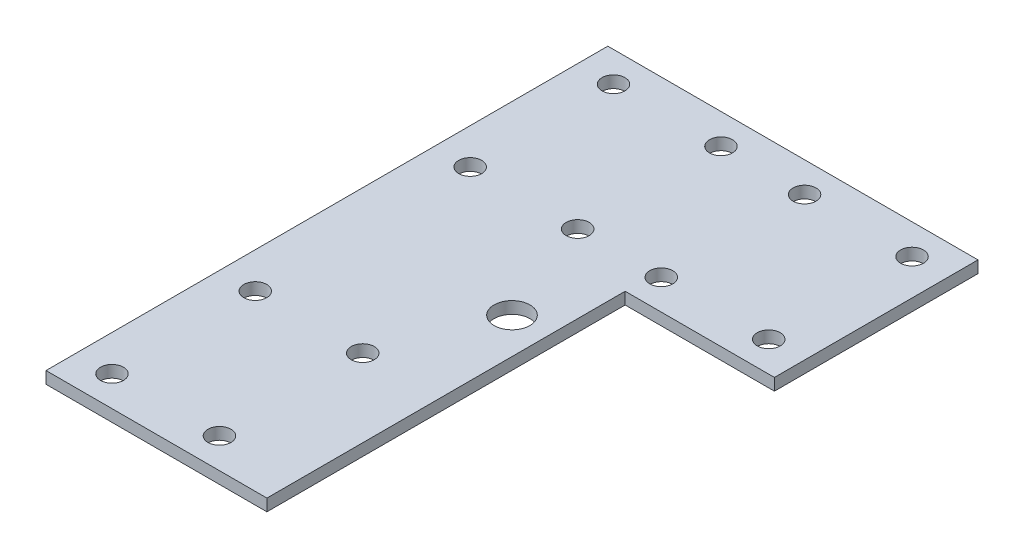
from build123d import *

# Parameters (mm, degrees)
SKETCH1_W           = 62
SKETCH1_H           = 94.1
SKETCH1_R           = 1.925
BOSS_EXTRUDE1_DEPTH = 2
SKETCH2_R           = 3
CUT_EXTRUDE1_DEPTH  = 113.706743365
CUT_EXTRUDE2_DEPTH  = 113.706743365


with BuildPart() as part:
    # Sketch1 → Boss-Extrude1 (new body)
    with BuildSketch(Plane(origin=(0, 0, 0), x_dir=(1, 0, 0), z_dir=(0, 1, 0))):
        with Locations((-31, 47.05)):
            Rectangle(SKETCH1_W, SKETCH1_H)
        with Locations(Location((-56, 89.05, 0), (0, 0, 270))):
            Circle(SKETCH1_R, mode=Mode.SUBTRACT)
        with Locations(Location((-38, 89.05, 0), (0, 0, 270))):
            Circle(SKETCH1_R, mode=Mode.SUBTRACT)
        with Locations(Location((-38, 65.05, 0), (0, 0, 270))):
            Circle(SKETCH1_R, mode=Mode.SUBTRACT)
        with Locations(Location((-56, 65.05, 0), (0, 0, 270))):
            Circle(SKETCH1_R, mode=Mode.SUBTRACT)
        with Locations(Location((-56, 29.05, 0), (0, 0, 270))):
            Circle(SKETCH1_R, mode=Mode.SUBTRACT)
        with Locations(Location((-38, 29.05, 0), (0, 0, 270))):
            Circle(SKETCH1_R, mode=Mode.SUBTRACT)
        with Locations(Location((-38, 5.05, 0), (0, 0, 270))):
            Circle(SKETCH1_R, mode=Mode.SUBTRACT)
        with Locations(Location((-56, 5.05, 0), (0, 0, 270))):
            Circle(SKETCH1_R, mode=Mode.SUBTRACT)
        with Locations(Location((-24, 89.05, 0), (0, 0, 270))):
            Circle(SKETCH1_R, mode=Mode.SUBTRACT)
        with Locations(Location((-6, 89.05, 0), (0, 0, 270))):
            Circle(SKETCH1_R, mode=Mode.SUBTRACT)
        with Locations(Location((-6, 65.05, 0), (0, 0, 270))):
            Circle(SKETCH1_R, mode=Mode.SUBTRACT)
        with Locations(Location((-24, 65.05, 0), (0, 0, 270))):
            Circle(SKETCH1_R, mode=Mode.SUBTRACT)
    extrude(amount=BOSS_EXTRUDE1_DEPTH)

    # Sketch2 → Cut-Extrude1 (cut, through all)
    with BuildSketch(Plane(origin=(0, 2, 0), x_dir=(1, 0, 0), z_dir=(0, 1, 0))):
        with Locations(Location((-31, 47.05, 0), (0, 0, 270))):
            Circle(SKETCH2_R)
    extrude(amount=-CUT_EXTRUDE1_DEPTH, mode=Mode.SUBTRACT)

    # Sketch4 → Cut-Extrude2 (cut, through all)
    with BuildSketch(Plane(origin=(0, 2, 0), x_dir=(1, 0, 0), z_dir=(0, 1, 0))):
        Polygon((0, 60), (-25, 60), (-25, 0), (0, 0), (0, 33.776627829), align=None)
    extrude(amount=-CUT_EXTRUDE2_DEPTH, mode=Mode.SUBTRACT)


solid = part.part
